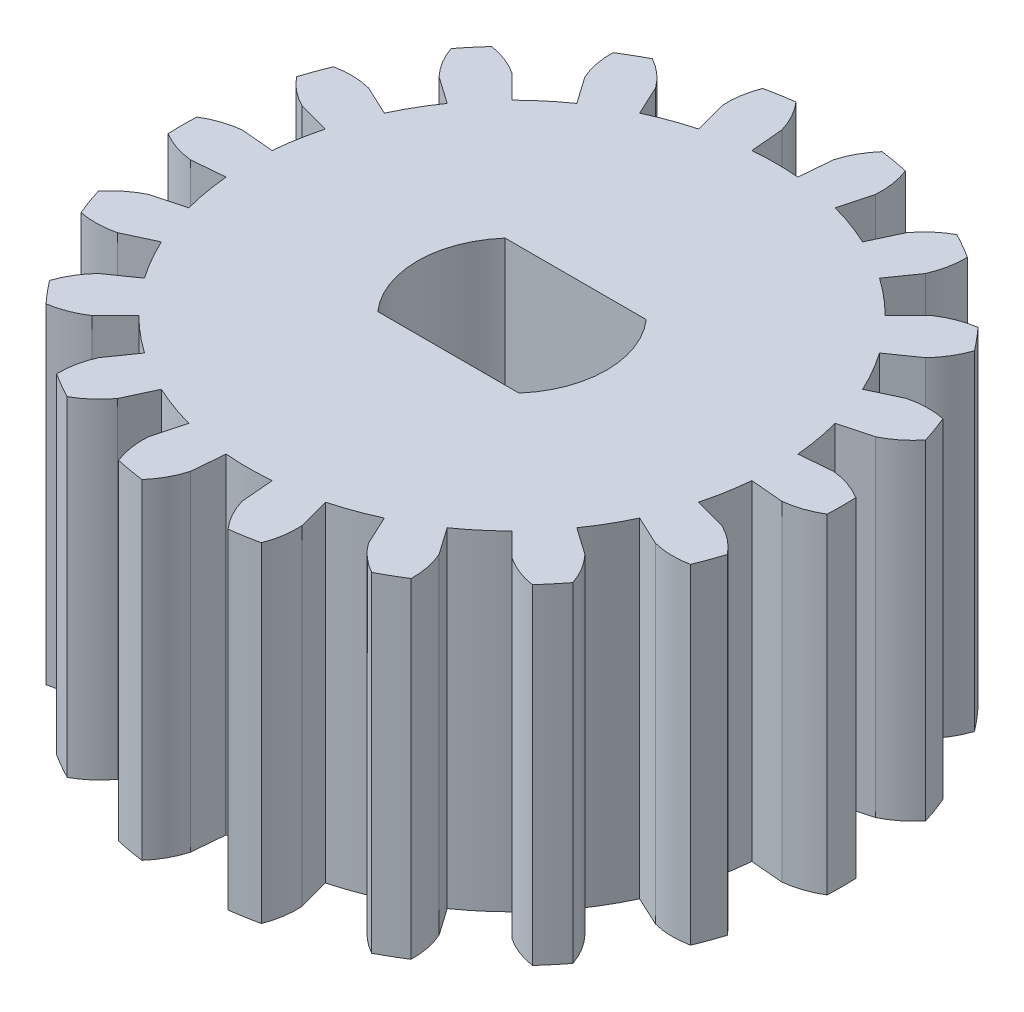
from build123d import *

# Parameters (mm, degrees)
BOSS_EXTRUDE1_DEPTH = 10
CIRPATTERN1_COUNT   = 18
CUT_EXTRUDE1_DEPTH  = 18.271256217


with BuildPart() as part:
    # Sketch1 → Boss-Extrude1 (new body)
    with BuildSketch(Plane(origin=(0, 0, 0), x_dir=(1, 0, 0), z_dir=(0, 1, 0))):
        with BuildLine():
            Line((7.969557585, 0.697245942), (8.965752283, 0.784401685))
            ThreePointArc((8.965752283, 0.784401685), (9.497437113, 0.667153604), (9.990482216, 0.436193874))
            ThreePointArc((9.990482216, 0.436193874), (10, 0), (9.990482216, -0.436193874))
            ThreePointArc((9.990482216, -0.436193874), (9.497437113, -0.667153604), (8.965752283, -0.784401685))
            Line((8.965752283, -0.784401685), (7.969557585, -0.697245942))
            ThreePointArc((7.969557585, -0.697245942), (7.931558891, -1.044209538), (7.878462024, -1.389185421))
            Line((7.878462024, -1.389185421), (0, 0))
            Line((0, 0), (7.878462024, 1.389185421))
            ThreePointArc((7.878462024, 1.389185421), (7.931558891, 1.044209538), (7.969557585, 0.697245942))
        make_face()
    boss_extrude1 = extrude(amount=BOSS_EXTRUDE1_DEPTH)

    # CirPattern1: Boss-Extrude1 ×18 about axis
    cirpattern1_axis = Axis((0, 0, 0), (0, 1, 0))
    for i in range(1, CIRPATTERN1_COUNT):
        add(boss_extrude1.rotate(cirpattern1_axis, i * 360 / CIRPATTERN1_COUNT))

    # Sketch6 → Cut-Extrude1 (cut, through all)
    with BuildSketch(Plane.XZ):
        with BuildLine():
            Line((-2.14, 1.93), (2.14, 1.93))
            ThreePointArc((2.14, 1.93), (2.868460939, 0), (2.14, -1.93))
            Line((2.14, -1.93), (-2.14, -1.93))
            ThreePointArc((-2.14, -1.93), (-2.868460939, 0), (-2.14, 1.93))
        make_face()
    extrude(amount=-CUT_EXTRUDE1_DEPTH, mode=Mode.SUBTRACT)


solid = part.part
